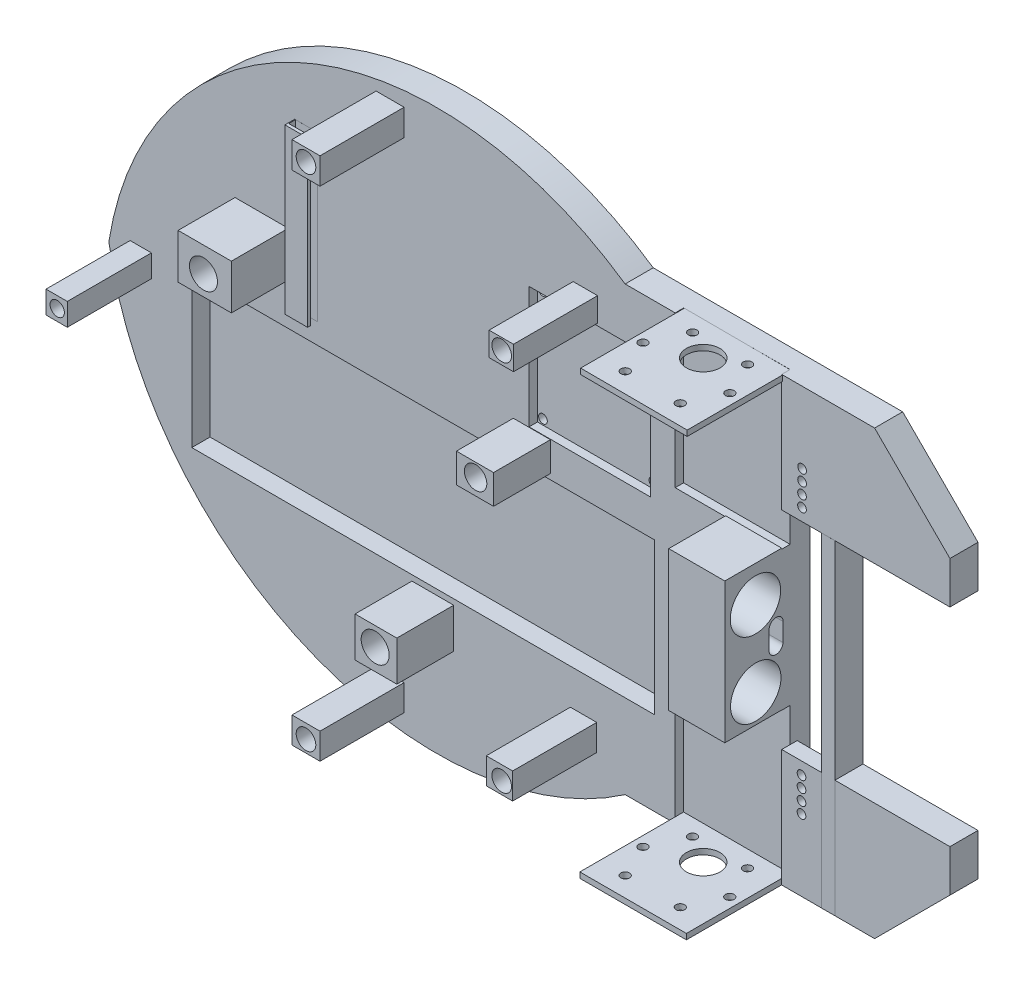
from build123d import *

# Parameters (mm, degrees)
BOSS_EXTRUDE1_DEPTH      = 10
BOSS_EXTRUDE1_DEPTH_BACK = 0.01
SKETCH3_W                = 38
SKETCH3_H                = 54
CUT_EXTRUDE1_DEPTH       = 3
SKETCH5_W                = 38
SKETCH5_H                = 54
CUT_EXTRUDE3_DEPTH       = 3
SKETCH7_W                = 165
SKETCH7_H                = 54
CUT_EXTRUDE4_DEPTH       = 6.5
SKETCH9_W                = 19
SKETCH9_H                = 16
SKETCH9_W_2              = 13.23867097
SKETCH9_H_2              = 10.44338859
SKETCH9_W_3              = 14.8958404
SKETCH9_H_3              = 14.23867097
BOSS_EXTRUDE2_DEPTH      = 20.3
SKETCH15_W               = 20
SKETCH15_H               = 50
BOSS_EXTRUDE3_DEPTH      = 20.3
SKETCH16_W               = 7.597238681
SKETCH16_H               = 8
SKETCH16_W_2             = 10
SKETCH16_H_2             = 9.4
SKETCH16_W_3             = 8.7
SKETCH16_H_3             = 8.5
SKETCH16_W_4             = 9.4
SKETCH16_H_4             = 9.3
BOSS_EXTRUDE4_DEPTH      = 30
SKETCH17_R               = 2.55
SKETCH17_R_2             = 3.5
CUT_EXTRUDE17_DEPTH      = 263.983651767
SKETCH18_W               = 43.4
SKETCH18_H               = 43.4
CUT_EXTRUDE18_DEPTH      = 3
SKETCH20_R               = 5
SKETCH20_R_2             = 4
CUT_EXTRUDE20_DEPTH      = 263.983651767
SKETCH21_R               = 9
CUT_EXTRUDE21_DEPTH      = 20
SKETCH22_R               = 1.55
CUT_EXTRUDE23_DEPTH      = 263.010307234
SKETCH25_W               = 8.1
SKETCH25_H               = 58.5
BOSS_EXTRUDE5_DEPTH      = 3.5
SKETCH26_W               = 7.81634734
SKETCH26_H               = 2.399791276
CUT_EXTRUDE24_DEPTH      = 58.5
SKETCH28_W               = 4.75290021
SKETCH28_H               = 9.947843747
BOSS_EXTRUDE6_DEPTH      = 115.870057685
SKETCH30_W               = 14.12
SKETCH30_H               = 25
CUT_EXTRUDE25_DEPTH      = 4.5
SKETCH33_R               = 1.55
CUT_EXTRUDE26_DEPTH      = 10.01
SKETCH36_W               = 38
SKETCH36_H               = 2
BOSS_EXTRUDE7_DEPTH      = 37
SKETCH39_R               = 6
SKETCH39_R_2             = 1.55
CUT_EXTRUDE28_DEPTH      = 2
SKETCH42_R               = 6
SKETCH42_R_2             = 1.55
CUT_EXTRUDE29_DEPTH      = 2


with BuildPart() as part:
    # Sketch1 → Boss-Extrude1 (new, two sides: drawn at the far end of the back side and taken through both)
    with BuildSketch(Plane.XY.offset(-BOSS_EXTRUDE1_DEPTH_BACK)):
        with BuildLine():
            Line((0, 0), (0, -37))
            Line((0, -37), (60, -37))
            Line((60, -37), (60, -52))
            Line((60, -52), (33.129942315, -78.870057685))
            Line((33.129942315, -78.870057685), (-55.850057685, -78.870057685))
            ThreePointArc((-55.850057685, -78.870057685), (-169.614041234, -90.257166815), (-239.999947532, -0.158696229))
            ThreePointArc((-239.999947532, -0.158696229), (-169.748285548, 90.207490359), (-55.850057685, 78.870057685))
            Line((-55.850057685, 78.870057685), (33.129942315, 78.870057685))
            Line((33.129942315, 78.870057685), (60, 52))
            Line((60, 52), (60, 37))
            Line((60, 37), (0, 37))
            Line((0, 37), (0, 0))
        make_face()
    extrude(amount=BOSS_EXTRUDE1_DEPTH + BOSS_EXTRUDE1_DEPTH_BACK)

    # Sketch3 → Cut-Extrude1 (cut)
    with BuildSketch(Plane.XY.offset(10)):
        with Locations((-19, 51.870057685)):
            Rectangle(SKETCH3_W, SKETCH3_H)
    extrude(amount=-CUT_EXTRUDE1_DEPTH, mode=Mode.SUBTRACT)

    # Sketch5 → Cut-Extrude3 (cut)
    with BuildSketch(Plane.XY.offset(10)):
        with Locations((-19, -51.870057685)):
            Rectangle(SKETCH5_W, SKETCH5_H)
    extrude(amount=-CUT_EXTRUDE3_DEPTH, mode=Mode.SUBTRACT)

    # Sketch7 → Cut-Extrude4 (cut)
    with BuildSketch(Plane.XY.offset(10)):
        with Locations((-127.91309413, -21.943838981)):
            Rectangle(SKETCH7_W, SKETCH7_H)
    extrude(amount=-CUT_EXTRUDE4_DEPTH, mode=Mode.SUBTRACT)

    # Sketch9 → Boss-Extrude2 (add)
    with BuildSketch(Plane.XY.offset(10)):
        with Locations((-185.5, 28)):
            Rectangle(SKETCH9_W, SKETCH9_H)
        with Locations((-89.112324575, 12.232539195)):
            Rectangle(SKETCH9_W_2, SKETCH9_H_2)
        with Locations((-124.438795754, -58.044490005)):
            Rectangle(SKETCH9_W_3, SKETCH9_H_3)
    extrude(amount=BOSS_EXTRUDE2_DEPTH)

    # Sketch15 → Boss-Extrude3 (add)
    with BuildSketch(Plane.XY.offset(10)):
        with Locations((-10, 0.20156489)):
            Rectangle(SKETCH15_W, SKETCH15_H)
    extrude(amount=BOSS_EXTRUDE3_DEPTH)

    # Sketch16 → Boss-Extrude4 (add)
    with BuildSketch(Plane.XY.offset(10)):
        with Locations((-228.62215183, 0)):
            Rectangle(SKETCH16_W, SKETCH16_H)
        with Locations((-139.68812176, 89.3492876)):
            Rectangle(SKETCH16_W_2, SKETCH16_H_2)
        with Locations((-70.02791219, 66.09880262)):
            Rectangle(SKETCH16_W_3, SKETCH16_H_3)
        with Locations((-70.67791219, -66.2732878)):
            Rectangle(SKETCH16_W_4, SKETCH16_H_4)
        with Locations((-139.68812176, -88.33151307)):
            Rectangle(SKETCH16_W_2, SKETCH16_H_4)
    extrude(amount=BOSS_EXTRUDE4_DEPTH)

    # Sketch17 → Cut-Extrude17 (cut, through all)
    with BuildSketch(Plane.XY):
        with Locations((-228.42077117, 0)):
            Circle(SKETCH17_R)
        with Locations((-139.68812176, 89.6492876)):
            Circle(SKETCH17_R_2)
        with Locations((-69.87791219, 66.34880262)):
            Circle(SKETCH17_R_2)
        with Locations((-69.87791219, -66.6232878)):
            Circle(SKETCH17_R_2)
        with Locations((-139.68812176, -88.68151307)):
            Circle(SKETCH17_R_2)
    extrude(amount=CUT_EXTRUDE17_DEPTH, mode=Mode.SUBTRACT)

    # Sketch18 → Cut-Extrude18 (cut)
    with BuildSketch(Plane.XY.offset(10)):
        with Locations((-68.42454895, 39.3)):
            Rectangle(SKETCH18_W, SKETCH18_H)
    extrude(amount=-CUT_EXTRUDE18_DEPTH, mode=Mode.SUBTRACT)

    # Sketch20 → Cut-Extrude20 (cut, through all)
    with BuildSketch(Plane.XY):
        with Locations((-185.94705048, 27.1120848)):
            Circle(SKETCH20_R)
        with Locations((-124.709385772, -57.612858016)):
            Circle(SKETCH20_R)
        with Locations((-88.8879152, 12.75038661)):
            Circle(SKETCH20_R_2)
    extrude(amount=CUT_EXTRUDE20_DEPTH, mode=Mode.SUBTRACT)

    # Sketch21 → Cut-Extrude21 (cut)
    with BuildSketch(Plane(origin=(0, 0, 0), x_dir=(0, 0, -1), z_dir=(1, 0, 0))):
        with Locations((-19.36187505, 12.37175029)):
            Circle(SKETCH21_R)
        with Locations((-19.26539558, -14.62824971)):
            Circle(SKETCH21_R)
        with BuildLine():
            Line((-9.491579533, 2.276446619), (-9.557448357, -4.178698144))
            ThreePointArc((-9.557448357, -4.178698144), (-12.081396215, -6.651657156), (-14.554355227, -4.127709299))
            Line((-14.554355227, -4.127709299), (-14.488486403, 2.327435464))
            ThreePointArc((-14.488486403, 2.327435464), (-11.964538545, 4.800394476), (-9.491579533, 2.276446619))
        make_face()
    extrude(amount=-CUT_EXTRUDE21_DEPTH, mode=Mode.SUBTRACT)

    # Sketch22 → Cut-Extrude23 (cut, through all)
    with BuildSketch(Plane.XY.offset(7)):
        with Locations((-88.16862044, 58.97947337)):
            Circle(SKETCH22_R)
        with Locations((-48.76862044, 58.97947337)):
            Circle(SKETCH22_R)
        with Locations((-48.76862044, 19.57947337)):
            Circle(SKETCH22_R)
        with Locations((-88.16862044, 19.57947337)):
            Circle(SKETCH22_R)
    extrude(amount=-CUT_EXTRUDE23_DEPTH, mode=Mode.SUBTRACT)

    # Sketch25 → Boss-Extrude5 (add)
    with BuildSketch(Plane.XY.offset(10)):
        with Locations((-169.64640613, 41.59949177)):
            Rectangle(SKETCH25_W, SKETCH25_H)
    extrude(amount=BOSS_EXTRUDE5_DEPTH)

    # Sketch26 → Cut-Extrude24 (cut)
    with BuildSketch(Plane.XZ.offset(-12.34949177)):
        with Locations((-169.5045798, 11.208428435)):
            Rectangle(SKETCH26_W, SKETCH26_H)
    extrude(amount=-CUT_EXTRUDE24_DEPTH, mode=Mode.SUBTRACT)

    # Sketch28 → Boss-Extrude6 (add)
    with BuildSketch(Plane.XZ.offset(78.870057685)):
        with Locations((16.603067585, 5.033719824)):
            Rectangle(SKETCH28_W, SKETCH28_H)
    extrude(amount=-BOSS_EXTRUDE6_DEPTH)

    # Sketch30 → Cut-Extrude25 (cut)
    with BuildSketch(Plane(origin=(0, 0, -0.01), x_dir=(-1, 0, 0), z_dir=(0, 0, -1))):
        with Locations((-7.06, -49.5)):
            Rectangle(SKETCH30_W, SKETCH30_H)
        Polygon((-14.38072485, 61.935396467), (-14.275539526, 36.935617747), (-0.155664505, 36.995026418), (-0.260849829, 61.994805138), align=None)
    extrude(amount=-CUT_EXTRUDE25_DEPTH, mode=Mode.SUBTRACT)

    # Sketch33 → Cut-Extrude26 (cut)
    with BuildSketch(Plane(origin=(0, 0, -0.01), x_dir=(-1, 0, 0), z_dir=(0, 0, -1))):
        with Locations((-7.06, -53.4)):
            Circle(SKETCH33_R)
        with Locations((-7.06, -49.4)):
            Circle(SKETCH33_R)
        with Locations((-7.06, -45.4)):
            Circle(SKETCH33_R)
        with Locations((-7.06, -41.4)):
            Circle(SKETCH33_R)
        with Locations((-7.228632788, 41.370889137)):
            Circle(SKETCH33_R)
        with Locations((-7.244931474, 45.370855931)):
            Circle(SKETCH33_R)
        with Locations((-7.261230159, 49.370822725)):
            Circle(SKETCH33_R)
        with Locations((-7.277528845, 53.370789519)):
            Circle(SKETCH33_R)
    extrude(amount=-CUT_EXTRUDE26_DEPTH, mode=Mode.SUBTRACT)

    # Sketch36 → Boss-Extrude7 (add)
    with BuildSketch(Plane.XY.offset(7)):
        Polygon((0.279518574, 78.814629504), (0.272425555, 76.814642082), (-37.727335467, 76.949409435), (-37.720242449, 78.949396858), align=None)
        with Locations((-19, -77.815125164)):
            Rectangle(SKETCH36_W, SKETCH36_H)
    extrude(amount=BOSS_EXTRUDE7_DEPTH)

    # Sketch39 → Cut-Extrude28 (cut)
    with BuildSketch(Plane.XZ.offset(78.815125164)):
        with Locations(Location((-19, 19, 0), (0, 0, 270))):
            Circle(SKETCH39_R)
        with Locations(Location((-34.499611559, 25.01055106, 0), (0, 0, 270))):
            Circle(SKETCH39_R_2)
        with Locations(Location((-3.563871147, 24.988758691, 0), (0, 0, 270))):
            Circle(SKETCH39_R_2)
        with Locations(Location((-28.819186805, 37.01055106, 0), (0, 0, 270))):
            Circle(SKETCH39_R_2)
        with Locations(Location((-9.177448314, 36.988758691, 0), (0, 0, 270))):
            Circle(SKETCH39_R_2)
        with Locations(Location((-28.819994175, 13.01055106, 0), (0, 0, 270))):
            Circle(SKETCH39_R_2)
        with Locations(Location((-9.230494356, 12.988758691, 0), (0, 0, 270))):
            Circle(SKETCH39_R_2)
    extrude(amount=-CUT_EXTRUDE28_DEPTH, mode=Mode.SUBTRACT)

    # Sketch42 → Cut-Extrude29 (cut)
    with BuildSketch(Plane(origin=(0.279518574, 78.814629504, 0), x_dir=(0.9999937111161443, -0.003546509292438372, 0), z_dir=(0.003546509292438372, 0.9999937111161443, 0))):
        with Locations(Location((-19.279713392, -19, 0), (0, 0, 180))):
            Circle(SKETCH42_R)
        with Locations(Location((-29.070149337, -13, 0), (0, 0, 180))):
            Circle(SKETCH42_R_2)
        with Locations(Location((-3.778432466, -25, 0), (0, 0, 180))):
            Circle(SKETCH42_R_2)
        with Locations(Location((-9.464104196, -13, 0), (0, 0, 180))):
            Circle(SKETCH42_R_2)
        with Locations(Location((-34.772326096, -25, 0), (0, 0, 180))):
            Circle(SKETCH42_R_2)
        with Locations(Location((-29.096493177, -37, 0), (0, 0, 180))):
            Circle(SKETCH42_R_2)
        with Locations(Location((-9.473371075, -37, 0), (0, 0, 180))):
            Circle(SKETCH42_R_2)
    extrude(amount=-CUT_EXTRUDE29_DEPTH, mode=Mode.SUBTRACT)


solid = part.part
